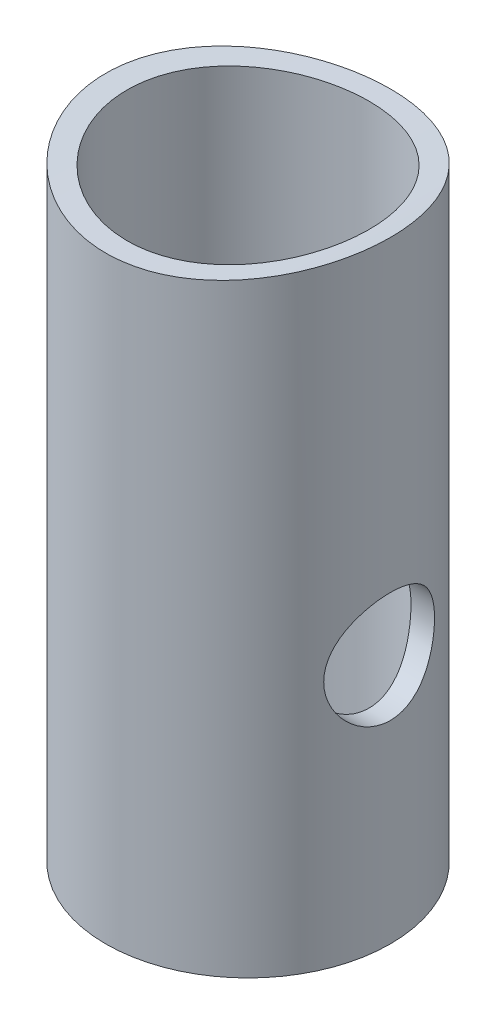
from build123d import *

# Parameters (mm, degrees)
SKETCH1_R               = 57.15
SKETCH1_R_2             = 48.59
BOSS_EXTRUDE1_DEPTH     = 245.75
CUT_EXTRUDE1_DEPTH      = 259.699260726
CUT_EXTRUDE1_DEPTH_BACK = 259.699260726
SKETCH3_R               = 22.25
CUT_EXTRUDE2_DEPTH      = 111


with BuildPart() as part:
    # Sketch1 → Boss-Extrude1 (new body)
    with BuildSketch(Plane(origin=(0, 0, 0), x_dir=(1, 0, 0), z_dir=(0, 1, 0))):
        with Locations(Location((0, 0, 0), (0, 0, 270))):
            Circle(SKETCH1_R)
        with Locations(Location((0, 0, 0), (0, 0, 270))):
            Circle(SKETCH1_R_2, mode=Mode.SUBTRACT)
    extrude(amount=BOSS_EXTRUDE1_DEPTH)

    # Sketch2 → Cut-Extrude1 (cut, two sides: drawn at the far end of the back side and taken through both)
    with BuildSketch(Plane.XY.offset(-CUT_EXTRUDE1_DEPTH_BACK)):
        with BuildLine():
            Line((57.15, 245.75), (-57.15, 245.75))
            ThreePointArc((-57.15, 245.75), (0, 240.316034778), (57.15, 245.75))
        make_face()
    extrude(amount=CUT_EXTRUDE1_DEPTH + CUT_EXTRUDE1_DEPTH_BACK, mode=Mode.SUBTRACT)

    # Sketch3 → Cut-Extrude2 (cut)
    with BuildSketch(Plane(origin=(0, 0, 0), x_dir=(0, 0, -1), z_dir=(1, 0, 0))):
        with Locations(Location((0, 100, 0), (0, 0, 180))):
            Circle(SKETCH3_R)
    extrude(amount=CUT_EXTRUDE2_DEPTH, mode=Mode.SUBTRACT)


solid = part.part
